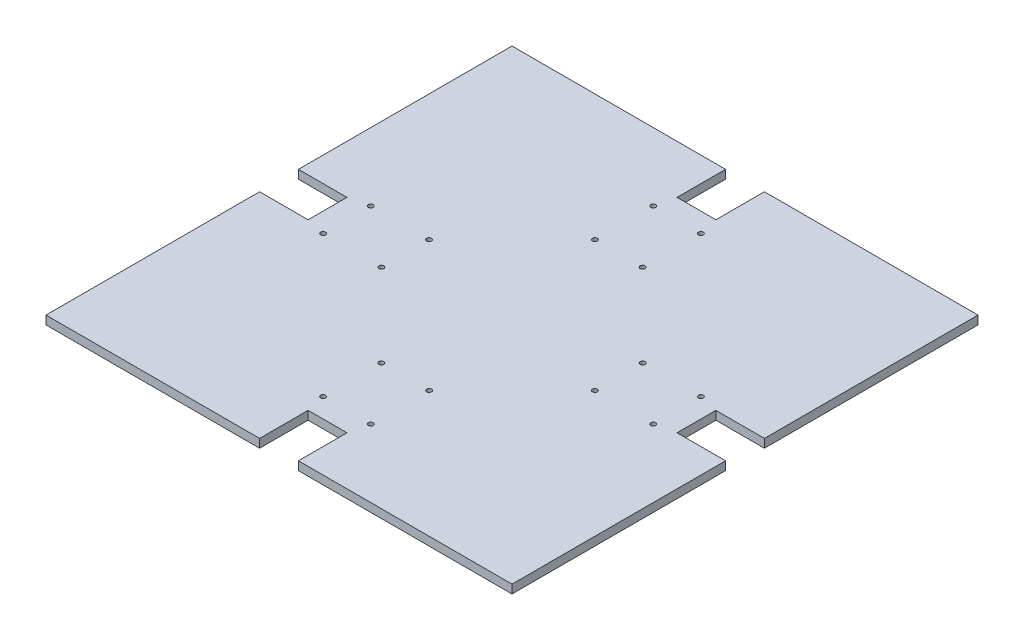
from build123d import *

# Parameters (mm, degrees)
SKETCH1_W           = 304.8
SKETCH1_H           = 304.8
BOSS_EXTRUDE1_DEPTH = 5.588
SKETCH2_R           = 1.6
SKETCH2_W           = 31.75
SKETCH2_H           = 25.4
SKETCH2_W_2         = 25.4
SKETCH2_H_2         = 31.75
CUT_EXTRUDE1_DEPTH  = 216.598575468


with BuildPart() as part:
    # Sketch1 → Boss-Extrude1 (new body)
    with BuildSketch(Plane(origin=(0, 0, 0), x_dir=(1, 0, 0), z_dir=(0, 1, 0))):
        Rectangle(SKETCH1_W, SKETCH1_H)
    extrude(amount=BOSS_EXTRUDE1_DEPTH)

    # Sketch2 → Cut-Extrude1 (cut, through all)
    with BuildSketch(Plane(origin=(0, 5.588, 0), x_dir=(1, 0, 0), z_dir=(0, 1, 0))):
        with Locations(Location((-107.95, 15.6, 0), (0, 0, 270))):
            Circle(SKETCH2_R)
        with Locations(Location((-69.85, 15.6, 0), (0, 0, 270))):
            Circle(SKETCH2_R)
        with Locations(Location((-107.95, -15.6, 0), (0, 0, 270))):
            Circle(SKETCH2_R)
        with Locations(Location((-69.85, -15.6, 0), (0, 0, 270))):
            Circle(SKETCH2_R)
        with Locations(Location((-15.6, -69.85, 0), (0, 0, 270))):
            Circle(SKETCH2_R)
        with Locations(Location((15.6, -69.85, 0), (0, 0, 270))):
            Circle(SKETCH2_R)
        with Locations(Location((-15.6, -107.95, 0), (0, 0, 270))):
            Circle(SKETCH2_R)
        with Locations(Location((15.6, -107.95, 0), (0, 0, 270))):
            Circle(SKETCH2_R)
        with Locations(Location((69.85, -15.6, 0), (0, 0, 270))):
            Circle(SKETCH2_R)
        with Locations(Location((69.85, 15.6, 0), (0, 0, 270))):
            Circle(SKETCH2_R)
        with Locations(Location((107.95, 15.6, 0), (0, 0, 270))):
            Circle(SKETCH2_R)
        with Locations(Location((107.95, -15.6, 0), (0, 0, 270))):
            Circle(SKETCH2_R)
        with Locations(Location((-15.6, 69.85, 0), (0, 0, 270))):
            Circle(SKETCH2_R)
        with Locations(Location((-15.6, 107.95, 0), (0, 0, 270))):
            Circle(SKETCH2_R)
        with Locations(Location((15.6, 107.95, 0), (0, 0, 270))):
            Circle(SKETCH2_R)
        with Locations(Location((15.6, 69.85, 0), (0, 0, 270))):
            Circle(SKETCH2_R)
        with Locations((-136.525, 0)):
            Rectangle(SKETCH2_W, SKETCH2_H)
        with Locations((0, 136.525)):
            Rectangle(SKETCH2_W_2, SKETCH2_H_2)
        with Locations((136.525, 0)):
            Rectangle(SKETCH2_W, SKETCH2_H)
        with Locations((0, -136.525)):
            Rectangle(SKETCH2_W_2, SKETCH2_H_2)
    extrude(amount=-CUT_EXTRUDE1_DEPTH, mode=Mode.SUBTRACT)


solid = part.part
